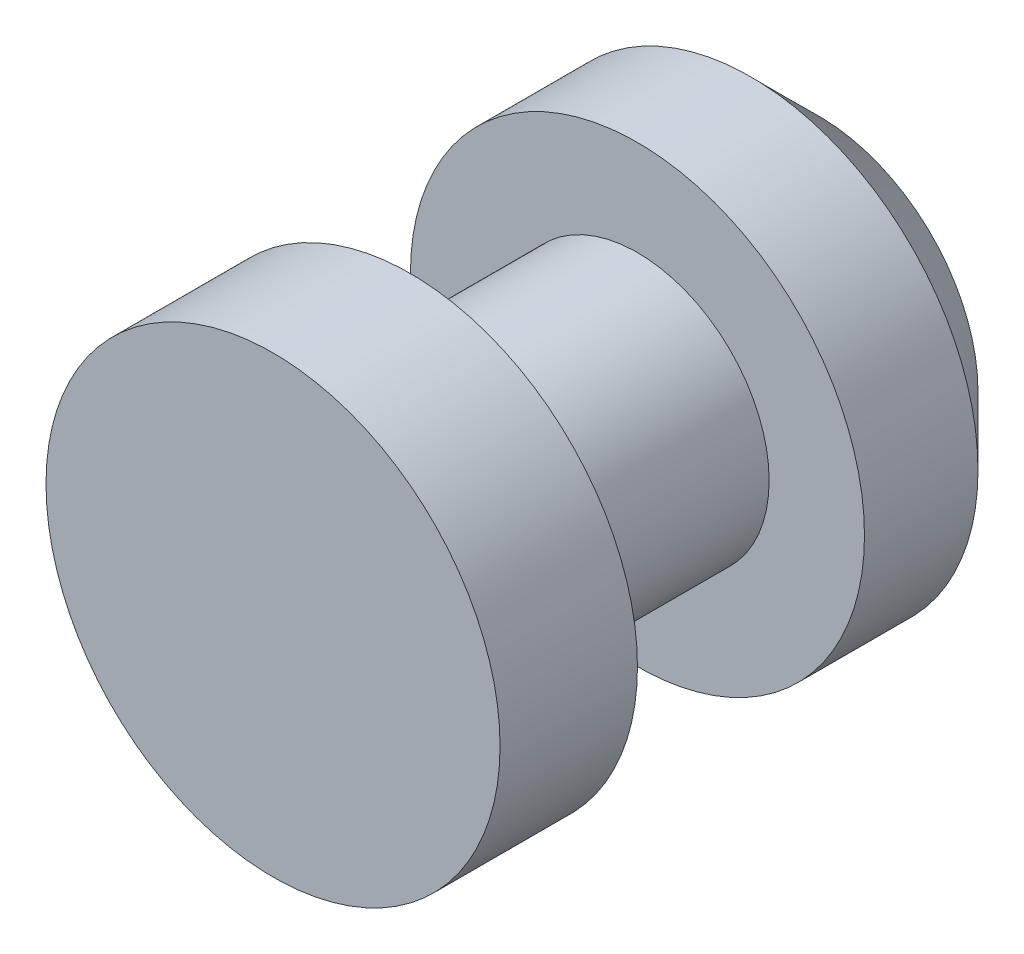
from build123d import *


with BuildPart() as part:
    # Sketch1 → Revolve1 (revolve)
    with BuildSketch(Plane(origin=(0, 0, 0), x_dir=(1, 0, 0), z_dir=(0, 1, 0)), mode=Mode.PRIVATE) as revolve1_sk:
        Polygon((0, -0.552592012), (0, 0.65), (-0.35, 0.65), (-0.5, 0.5), (-0.5, 0.25), (-0.29, 0.25), (-0.29, -0.25), (-0.5, -0.25), (-0.5, -0.552592012), align=None)
    revolve(revolve1_sk.sketch.rotate(Axis((0, 0, 0.552592012), (0, 0, -1)), 180), axis=Axis((0, 0, 0.552592012), (0, 0, -1)))


solid = part.part
